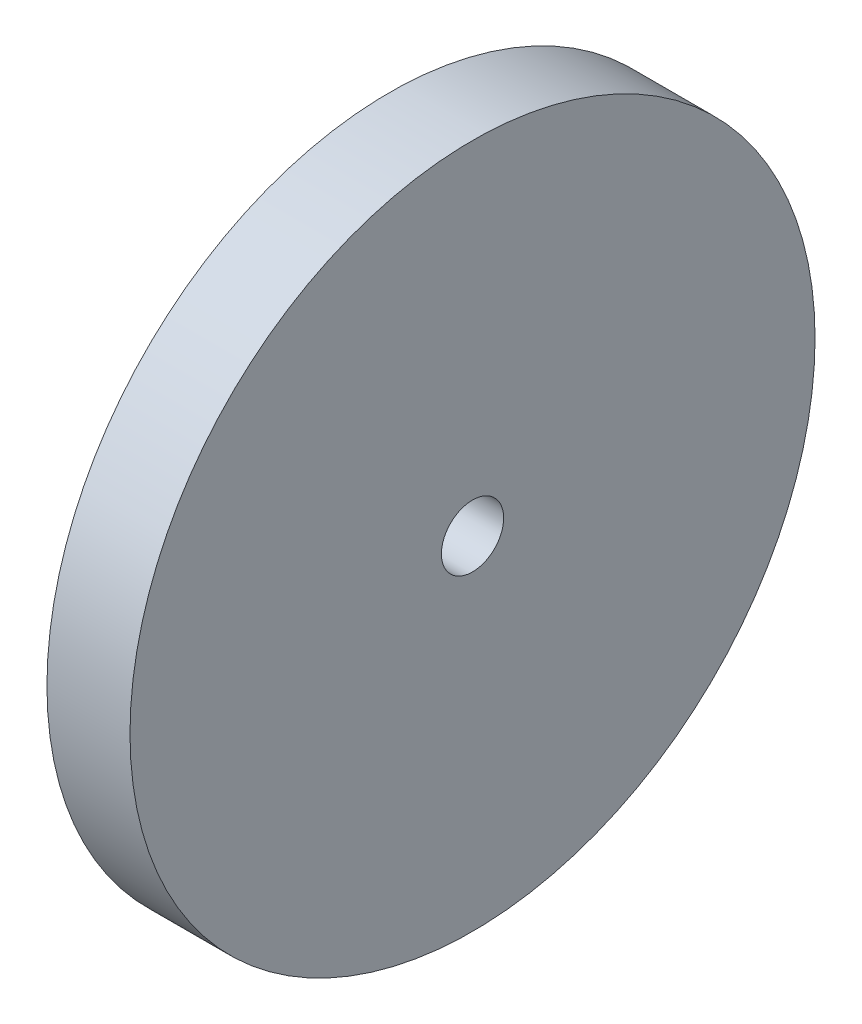
from build123d import *

# Parameters (mm, degrees)
ESBO_O1_R                = 16.5
ESBO_O1_R_2              = 1.5
RESSALTO_EXTRUS_O1_DEPTH = 4


with BuildPart() as part:
    # Esboço1 → Ressalto-extrusão1 (new body)
    with BuildSketch(Plane(origin=(0, 0, 0), x_dir=(0, 0, -1), z_dir=(1, 0, 0))):
        Circle(ESBO_O1_R)
        Circle(ESBO_O1_R_2, mode=Mode.SUBTRACT)
    extrude(amount=RESSALTO_EXTRUS_O1_DEPTH)


solid = part.part
